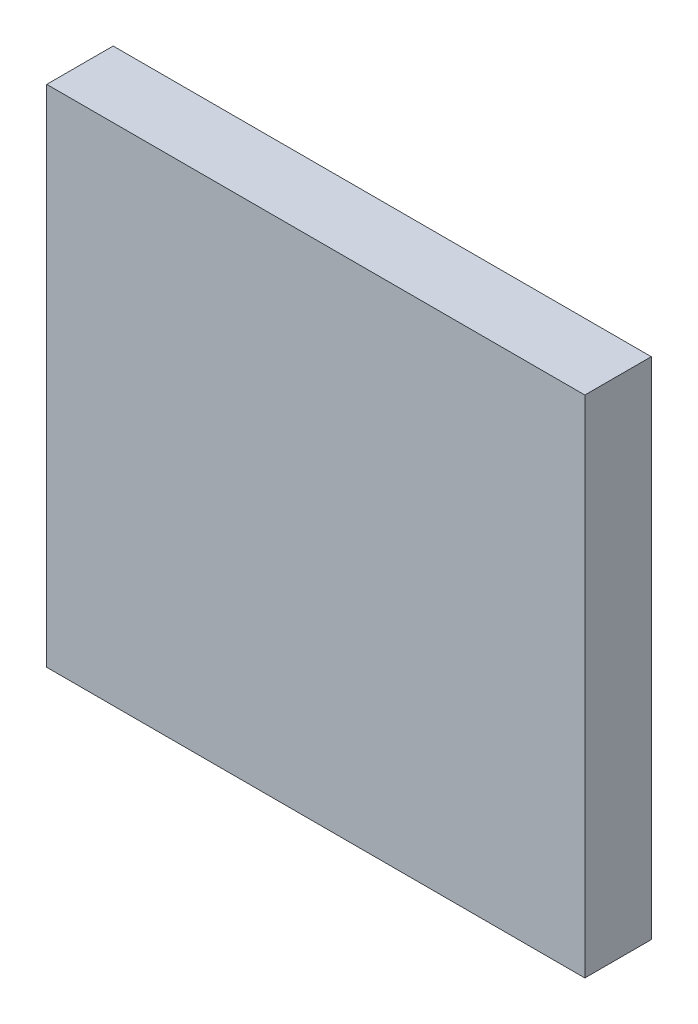
from build123d import *

# Parameters (mm, degrees)
SKETCH1_W               = 8.1016
SKETCH1_H               = 7.6016
COMPONENT_OUTLINE_DEPTH = 1


with BuildPart() as part:
    # Sketch1 → Component_Outline (new body)
    with BuildSketch(Plane.XY):
        with Locations((-0.0508, -0.8008)):
            Rectangle(SKETCH1_W, SKETCH1_H)
    extrude(amount=COMPONENT_OUTLINE_DEPTH)


solid = part.part
